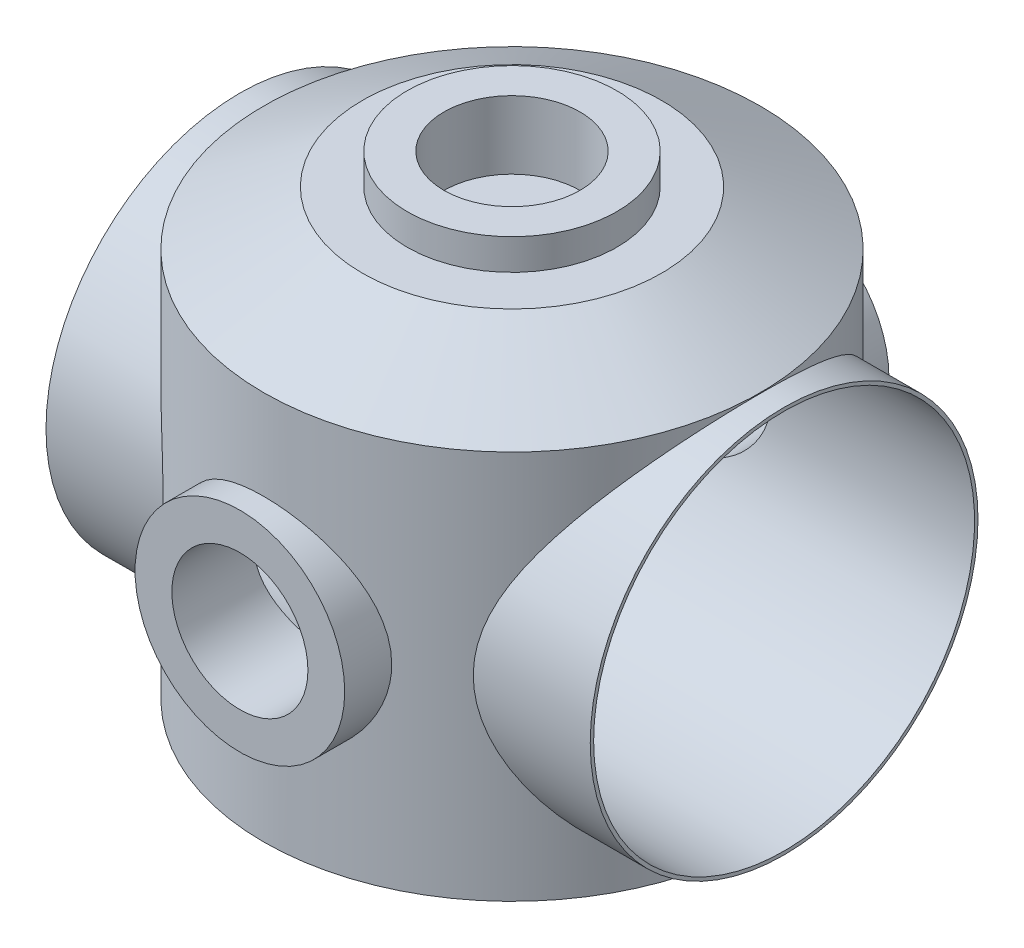
from build123d import *
from build123d.topology import SkipClean

# Parameters (mm, degrees)
SKETCH1_W                = 25.809397514
SKETCH1_H                = 25.809397514
BOSS_EXTRUDE1_DEPTH      = 28.6
BOSS_EXTRUDE3_DEPTH      = 28.6
CUT_EXTRUDE4_DEPTH       = 42.564184101
CUT_EXTRUDE4_DEPTH_BACK  = 42.564184101
SKETCH4_R                = 14.25
SKETCH5_R                = 14.25
SKETCH5_R_2              = 14
BOSS_EXTRUDE4_DEPTH      = 20
SKETCH6_R                = 7.705
BOSS_EXTRUDE5_DEPTH      = 2.27
SKETCH7_R                = 5
CUT_EXTRUDE5_DEPTH       = 5
BOSS_EXTRUDE7_REACH      = 66.131
BOSS_EXTRUDE7_END_RADIUS = 18.25
BOSS_EXTRUDE7_START      = 20
SKETCH8_R                = 7.705
CUT_EXTRUDE8_DEPTH       = 57.696759272
CUT_EXTRUDE8_DEPTH_BACK  = 57.696759272
SKETCH12_R               = 5


with BuildPart() as part:
    # Sketch1 → Boss-Extrude1 (new body)
    with BuildSketch(Plane(origin=(0, 0, 0), x_dir=(1, 0, 0), z_dir=(0, 1, 0))):
        Rectangle(SKETCH1_W, SKETCH1_H)
    extrude(amount=BOSS_EXTRUDE1_DEPTH)

    # Sketch2 → Revolve1 (revolve)
    with BuildSketch(Plane.ZY):
        Polygon((0, 0), (0, -3.98), (11, -3.98), (18.25, 0), align=None)
    revolve1 = revolve(axis=Axis((0, 0, 0), (0, -1, 0)))

    # Mirror2: Revolve1 across plane
    add(revolve1.mirror(Plane(origin=(0, 14.3, 0), x_dir=(0, 0, 1), z_dir=(0, -1, 0))))

    # Sketch1<4> → Boss-Extrude3 (add)
    with BuildSketch(Plane(origin=(0, 0, 0), x_dir=(1, 0, 0), z_dir=(0, 1, 0))):
        with BuildLine():
            ThreePointArc((12.904698757, 12.904698757), (0, 18.25), (-12.904698757, 12.904698757))
            Line((-12.904698757, 12.904698757), (12.904698757, 12.904698757))
        make_face()
        with BuildLine():
            Line((-12.904698757, -12.904698757), (-12.904698757, 12.904698757))
            ThreePointArc((-12.904698757, 12.904698757), (-18.25, 0), (-12.904698757, -12.904698757))
        make_face()
        with BuildLine():
            ThreePointArc((12.904698757, -12.904698757), (18.25, 0), (12.904698757, 12.904698757))
            Line((12.904698757, 12.904698757), (12.904698757, -12.904698757))
        make_face()
        with BuildLine():
            Line((12.904698757, -12.904698757), (-12.904698757, -12.904698757))
            ThreePointArc((-12.904698757, -12.904698757), (0, -18.25), (12.904698757, -12.904698757))
        make_face()
    extrude(amount=BOSS_EXTRUDE3_DEPTH)

    # Sketch4 → Cut-Extrude4 (cut, two sides: drawn at the far end of the back side and taken through both)
    with SkipClean():  # the faces are left unmerged after this step: merging them gives an invalid solid
        with BuildSketch(Plane.ZY.offset(-CUT_EXTRUDE4_DEPTH_BACK)):
            with Locations((0, 14.3)):
                Circle(SKETCH4_R)
        extrude(amount=CUT_EXTRUDE4_DEPTH + CUT_EXTRUDE4_DEPTH_BACK, mode=Mode.SUBTRACT)

    # Sketch5 → Boss-Extrude4 (add, symmetric)
    with SkipClean():  # the faces are left unmerged after this step: merging them gives an invalid solid
        with BuildSketch(Plane.ZY):
            with Locations((0, 14.3)):
                Circle(SKETCH5_R)
            with Locations((0, 14.3)):
                Circle(SKETCH5_R_2, mode=Mode.SUBTRACT)
        extrude(amount=BOSS_EXTRUDE4_DEPTH, both=True)

    # Sketch6 → Boss-Extrude5 (add)
    with SkipClean():  # the faces are left unmerged after this step: merging them gives an invalid solid
        with BuildSketch(Plane(origin=(0, 32.58, 0), x_dir=(1, 0, 0), z_dir=(0, 1, 0))):
            Circle(SKETCH6_R)
        extrude(amount=BOSS_EXTRUDE5_DEPTH)

    # Sketch7 → Cut-Extrude5 (cut)
    with SkipClean():  # the faces are left unmerged after this step: merging them gives an invalid solid
        with BuildSketch(Plane(origin=(0, 34.85, 0), x_dir=(1, 0, 0), z_dir=(0, 1, 0))):
            Circle(SKETCH7_R)
        extrude(amount=-CUT_EXTRUDE5_DEPTH, mode=Mode.SUBTRACT)

    # Boss-Extrude7: up to this cylinder (the profile starts outside it)
    with SkipClean():  # the faces are left unmerged after this step: merging them gives an invalid solid
        boss_extrude7_end = Plane(origin=(0, 14.3, 0), z_dir=(0, -1, 0)) * Cylinder(BOSS_EXTRUDE7_END_RADIUS, 169.762, mode=Mode.PRIVATE)
        # Sketch8 → Boss-Extrude7 (add, up to the surface)
        with BuildSketch(Plane.XY.offset(BOSS_EXTRUDE7_START), mode=Mode.PRIVATE) as boss_extrude7_sk1:
            with Locations((0, 14.3)):
                Circle(SKETCH8_R)
        boss_extrude7_tool1 = extrude(boss_extrude7_sk1.sketch, amount=-BOSS_EXTRUDE7_REACH, mode=Mode.PRIVATE) - boss_extrude7_end
        boss_extrude7 = boss_extrude7_tool1.solids().sort_by_distance((0, 14.3, 20))[0]
        add(boss_extrude7)

    # Mirror5: Boss-Extrude7 across plane
    with SkipClean():  # the faces are left unmerged after this step: merging them gives an invalid solid
        add(boss_extrude7.mirror(Plane.XY))

    # Sketch12 → Cut-Extrude8 (cut, two sides: drawn at the far end of the back side and taken through both)
    with SkipClean():  # the faces are left unmerged after this step: merging them gives an invalid solid
        with BuildSketch(Plane.XY.offset(20).offset(-CUT_EXTRUDE8_DEPTH_BACK)):
            with Locations((0, 14.3)):
                Circle(SKETCH12_R)
        extrude(amount=CUT_EXTRUDE8_DEPTH + CUT_EXTRUDE8_DEPTH_BACK, mode=Mode.SUBTRACT)


solid = part.part
